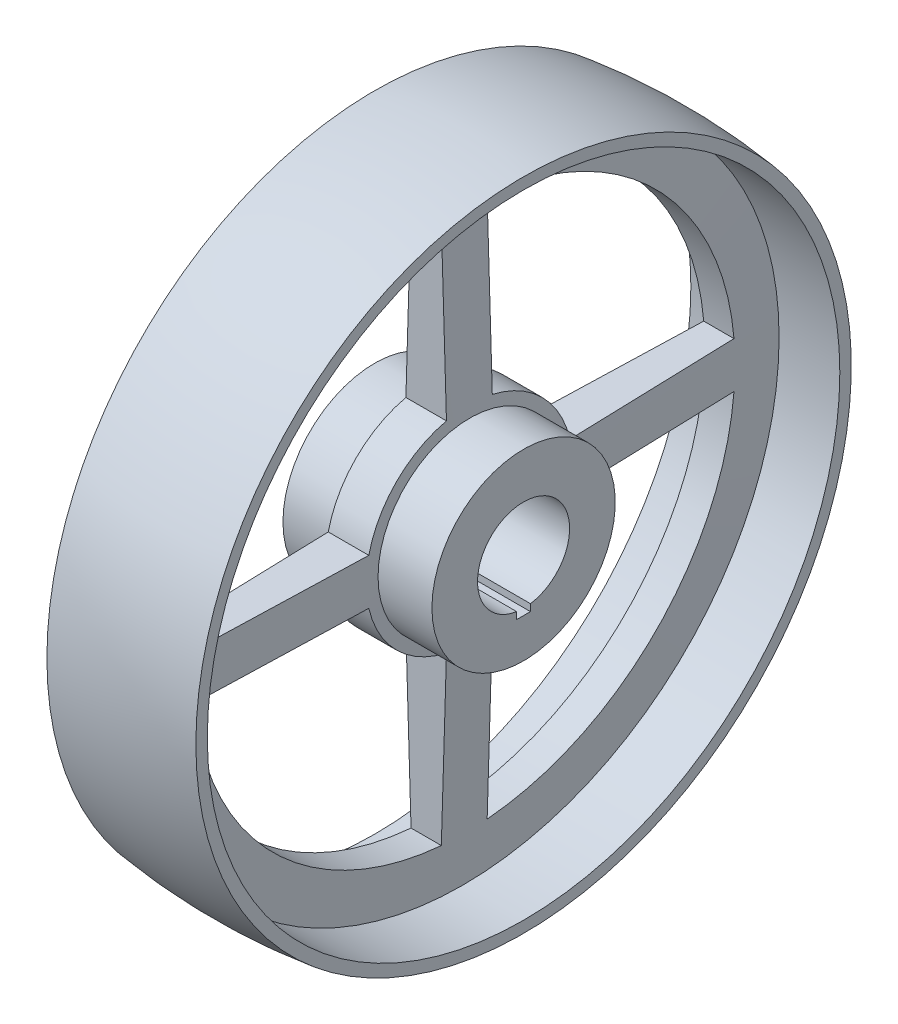
from build123d import *

# Parameters (mm, degrees)
CUT_EXTRUDE4_DEPTH      = 208.620447125
CUT_EXTRUDE4_DEPTH_BACK = 208.620447125
CUT_EXTRUDE5_DEPTH      = 216.116247808
CUT_EXTRUDE5_DEPTH_BACK = 216.116247808


with BuildPart() as part:
    # Sketch2 → Revolve2 (revolve)
    with BuildSketch(Plane.XY, mode=Mode.PRIVATE) as revolve2_sk:
        with BuildLine():
            Line((32.5, 20), (32.5, 40))
            Line((32.5, 40), (9, 40))
            Line((9, 40), (6, 138))
            Line((6, 138), (32.5, 138))
            Line((32.5, 138), (32.5, 143))
            ThreePointArc((32.5, 143), (0, 145), (-32.5, 143))
            Line((-32.5, 143), (-32.5, 138))
            Line((-32.5, 138), (-6, 138))
            Line((-6, 138), (-9, 40))
            Line((-9, 40), (-32.5, 40))
            Line((-32.5, 40), (-32.5, 20))
            Line((-32.5, 20), (32.5, 20))
        make_face()
    revolve(revolve2_sk.sketch.rotate(Axis((-129.939855751, 0, 0), (1, 0, 0)), 90), axis=Axis((-129.939855751, 0, 0), (1, 0, 0)))

    # Sketch3 → Cut-Extrude4 (cut, two sides: drawn at the far end of the back side and taken through both)
    with BuildSketch(Plane(origin=(0, 0, 0), x_dir=(0, 0, -1), z_dir=(1, 0, 0)).offset(-CUT_EXTRUDE4_DEPTH_BACK)):
        with BuildLine():
            Line((10, 117.714149843), (10, 43.874821937))
            ThreePointArc((10, 43.874821937), (31.819805153, 31.819805153), (43.874821937, 10))
            Line((43.874821937, 10), (117.714149843, 10))
            ThreePointArc((117.714149843, 10), (83.536282755, 83.536282755), (10, 117.714149843))
        make_face()
        with BuildLine():
            Line((-10, 117.714149843), (-10, 43.874821937))
            ThreePointArc((-10, 43.874821937), (-31.819805153, 31.819805153), (-43.874821937, 10))
            Line((-43.874821937, 10), (-117.714149843, 10))
            ThreePointArc((-117.714149843, 10), (-83.536282755, 83.536282755), (-10, 117.714149843))
        make_face()
        with BuildLine():
            Line((117.714149843, -10), (43.874821937, -10))
            ThreePointArc((43.874821937, -10), (31.819805153, -31.819805153), (10, -43.874821937))
            Line((10, -43.874821937), (10, -117.714149843))
            ThreePointArc((10, -117.714149843), (83.536282755, -83.536282755), (117.714149843, -10))
        make_face()
        with BuildLine():
            Line((-10, -117.714149843), (-10, -43.874821937))
            ThreePointArc((-10, -43.874821937), (-31.819805153, -31.819805153), (-43.874821937, -10))
            Line((-43.874821937, -10), (-117.714149843, -10))
            ThreePointArc((-117.714149843, -10), (-83.536282755, -83.536282755), (-10, -117.714149843))
        make_face()
    extrude(amount=CUT_EXTRUDE4_DEPTH + CUT_EXTRUDE4_DEPTH_BACK, mode=Mode.SUBTRACT)

    # Sketch4 → Cut-Extrude5 (cut, two sides: drawn at the far end of the back side and taken through both)
    with BuildSketch(Plane(origin=(32.5, 0, 0), x_dir=(0, 0, -1), z_dir=(1, 0, 0)).offset(-CUT_EXTRUDE5_DEPTH_BACK)):
        with BuildLine():
            Line((3, -19.866261329), (3, -22.866261329))
            Line((3, -22.866261329), (-3, -22.866261329))
            Line((-3, -22.866261329), (-3, -19.866261329))
            ThreePointArc((-3, -19.866261329), (0, 20.091499177), (3, -19.866261329))
        make_face()
    extrude(amount=CUT_EXTRUDE5_DEPTH + CUT_EXTRUDE5_DEPTH_BACK, mode=Mode.SUBTRACT)


solid = part.part
